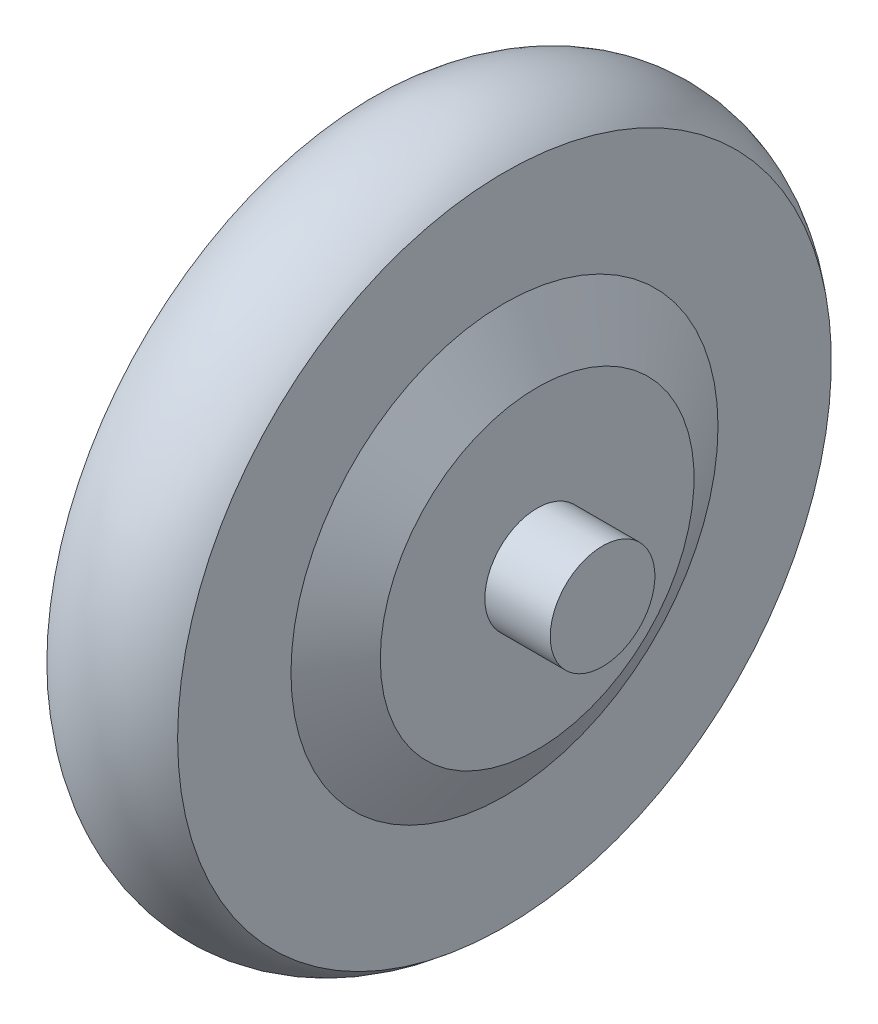
from build123d import *

# Parameters (mm, degrees)
EXTRUDE_1_DEPTH      = 10
EXTRUDE_1_DEPTH_BACK = 48
SKETCH_2_R           = 8
SKETCH_3_W           = 4.4
SKETCH_3_H           = 8
EXTRUDE_2_DEPTH      = 14


with BuildPart() as part:
    # 草图1 → 旋转1 (revolve)
    with BuildSketch(Plane.XY, mode=Mode.PRIVATE) as revolve_1_sk:
        with BuildLine():
            Line((20, 0), (25, 0))
            Line((25, 0), (25, 24))
            Line((25, 24), (20, 32.660254038))
            Line((20, 32.660254038), (20, 50))
            ThreePointArc((20, 50), (10, 53.819660113), (0, 50))
            Line((0, 50), (0, 32.660254038))
            Line((0, 32.660254038), (-5, 24))
            Line((-5, 24), (-5, 12))
            Line((-5, 12), (-13, 12))
            Line((-13, 12), (-13, 0))
            Line((-13, 0), (-5, 0))
            Line((-5, 0), (0, 0))
            Line((0, 0), (20, 0))
        make_face()
    revolve(revolve_1_sk.sketch.rotate(Axis((0, 0, 0), (1, 0, 0)), 90), axis=Axis((0, 0, 0), (1, 0, 0)))

    # 草图2 → 凸台-拉伸1 (add, two sides: drawn at the far end of the back side and taken through both)
    with BuildSketch(Plane.ZY.offset(13).offset(-EXTRUDE_1_DEPTH_BACK)):
        Circle(SKETCH_2_R)
    extrude(amount=EXTRUDE_1_DEPTH + EXTRUDE_1_DEPTH_BACK)

    # 草图3 → 凸台-拉伸2 (add)
    with BuildSketch(Plane(origin=(0, 0, 0), x_dir=(1, 0, 0), z_dir=(0, 1, 0))):
        with Locations((-9, 0)):
            Rectangle(SKETCH_3_W, SKETCH_3_H)
    extrude(amount=EXTRUDE_2_DEPTH)


solid = part.part
